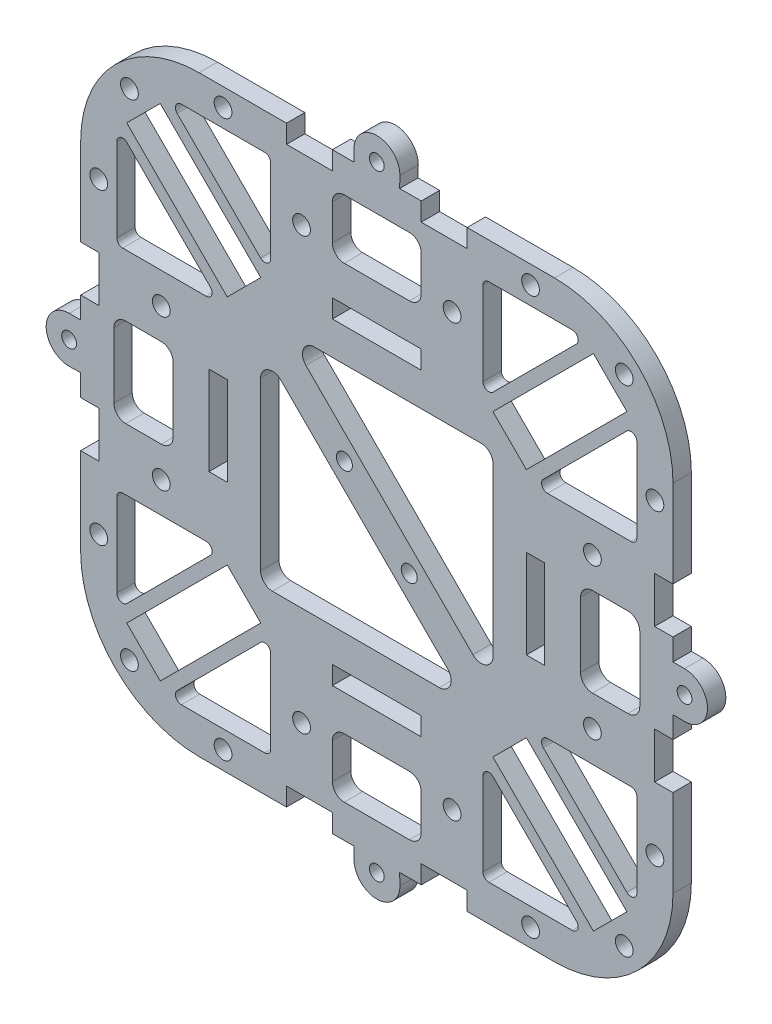
from build123d import *

# Parameters (mm, degrees)
SKETCH1_R      = 1.25
SKETCH1_R_2    = 1.5
SKETCH1_R_3    = 1.35
SKETCH1_W      = 15
SKETCH1_H      = 3.1
SKETCH1_W_2    = 3.1
SKETCH1_H_2    = 15
EXTRUDE1_DEPTH = 3.1


with BuildPart() as part:
    # Sketch1 → Extrude1 (new body)
    with BuildSketch(Plane.XY):
        with BuildLine():
            Line((11.101326835, -64.245781149), (7.453785482, -64.245781149))
            Line((7.453785482, -64.245781149), (7.453785482, -61.145781149))
            Line((7.453785482, -61.145781149), (-0.296214518, -61.145781149))
            Line((-0.296214518, -61.145781149), (-0.296214518, -64.245781149))
            Line((-0.296214518, -64.245781149), (-15.046214518, -64.245781149))
            ThreePointArc((-15.046214518, -64.245781149), (-29.188350141, -58.387916773), (-35.046214518, -44.245781149))
            Line((-35.046214518, -44.245781149), (-35.046214518, -29.495781149))
            Line((-35.046214518, -29.495781149), (-31.946214518, -29.495781149))
            Line((-31.946214518, -29.495781149), (-31.946214518, -21.745781149))
            Line((-31.946214518, -21.745781149), (-35.046214518, -21.745781149))
            Line((-35.046214518, -21.745781149), (-35.046214518, -18.098239797))
            Line((-35.046214518, -18.098239797), (-36.996214518, -18.143322501))
            ThreePointArc((-36.996214518, -18.143322501), (-40.871214518, -14.268322501), (-36.996214518, -10.393322501))
            Line((-36.996214518, -10.393322501), (-35.046214518, -10.393322501))
            Line((-35.046214518, -10.393322501), (-35.046214518, -6.745781149))
            Line((-35.046214518, -6.745781149), (-31.946214518, -6.745781149))
            Line((-31.946214518, -6.745781149), (-31.946214518, 1.004218851))
            Line((-31.946214518, 1.004218851), (-35.046214518, 1.004218851))
            Line((-35.046214518, 1.004218851), (-35.046214518, 15.754218851))
            ThreePointArc((-35.046214518, 15.754218851), (-29.188350141, 29.896354475), (-15.046214518, 35.754218851))
            Line((-15.046214518, 35.754218851), (-0.296214518, 35.754218851))
            Line((-0.296214518, 35.754218851), (-0.296214518, 32.654218851))
            Line((-0.296214518, 32.654218851), (7.453785482, 32.654218851))
            Line((7.453785482, 32.654218851), (7.453785482, 35.754218851))
            Line((7.453785482, 35.754218851), (11.101326835, 35.754218851))
            Line((11.101326835, 35.754218851), (11.101326835, 37.704218851))
            ThreePointArc((11.101326835, 37.704218851), (14.976326835, 41.579218851), (18.851326835, 37.704218851))
            Line((18.851326835, 37.704218851), (18.80624413, 35.754218851))
            Line((18.80624413, 35.754218851), (22.453785482, 35.754218851))
            Line((22.453785482, 35.754218851), (22.453785482, 32.654218851))
            Line((22.453785482, 32.654218851), (30.203785482, 32.654218851))
            Line((30.203785482, 32.654218851), (30.203785482, 35.754218851))
            Line((30.203785482, 35.754218851), (44.953785482, 35.754218851))
            ThreePointArc((44.953785482, 35.754218851), (59.095921106, 29.896354475), (64.953785482, 15.754218851))
            Line((64.953785482, 15.754218851), (64.953785482, 1.004218851))
            Line((64.953785482, 1.004218851), (61.853785482, 1.004218851))
            Line((61.853785482, 1.004218851), (61.853785482, -6.745781149))
            Line((61.853785482, -6.745781149), (64.953785482, -6.745781149))
            Line((64.953785482, -6.745781149), (64.953785482, -10.393322501))
            Line((64.953785482, -10.393322501), (66.903785482, -10.393322501))
            ThreePointArc((66.903785482, -10.393322501), (70.778785482, -14.268322501), (66.903785482, -18.143322501))
            Line((66.903785482, -18.143322501), (64.953785482, -18.098239797))
            Line((64.953785482, -18.098239797), (64.953785482, -21.745781149))
            Line((64.953785482, -21.745781149), (61.853785482, -21.745781149))
            Line((61.853785482, -21.745781149), (61.853785482, -29.495781149))
            Line((61.853785482, -29.495781149), (64.953785482, -29.495781149))
            Line((64.953785482, -29.495781149), (64.953785482, -44.245781149))
            ThreePointArc((64.953785482, -44.245781149), (59.095921106, -58.387916773), (44.953785482, -64.245781149))
            Line((44.953785482, -64.245781149), (30.203785482, -64.245781149))
            Line((30.203785482, -64.245781149), (30.203785482, -61.145781149))
            Line((30.203785482, -61.145781149), (22.453785482, -61.145781149))
            Line((22.453785482, -61.145781149), (22.453785482, -64.245781149))
            Line((22.453785482, -64.245781149), (18.80624413, -64.245781149))
            Line((18.80624413, -64.245781149), (18.851326835, -66.195781149))
            ThreePointArc((18.851326835, -66.195781149), (14.976326835, -70.070781149), (11.101326835, -66.195781149))
            Line((11.101326835, -66.195781149), (11.101326835, -64.245781149))
        make_face()
        with Locations(Location((-36.996214518, -14.245781149, 0), (0, 0, 180))):
            Circle(SKETCH1_R, mode=Mode.SUBTRACT)
        with Locations(Location((66.903785482, -14.245781149, 0), (0, 0, 180))):
            Circle(SKETCH1_R, mode=Mode.SUBTRACT)
        with Locations(Location((14.953785482, -66.195781149, 0), (0, 0, 180))):
            Circle(SKETCH1_R, mode=Mode.SUBTRACT)
        with Locations(Location((14.953785482, 37.704218851, 0), (0, 0, 180))):
            Circle(SKETCH1_R, mode=Mode.SUBTRACT)
        with Locations(Location((-26.81398147, -56.013548102, 0), (0, 0, 180))):
            Circle(SKETCH1_R_2, mode=Mode.SUBTRACT)
        with Locations(Location((56.721552435, -56.013548102, 0), (0, 0, 180))):
            Circle(SKETCH1_R_2, mode=Mode.SUBTRACT)
        with Locations(Location((-31.996593315, -40.204150588, 0), (0, 0, 180))):
            Circle(SKETCH1_R_2, mode=Mode.SUBTRACT)
        with Locations(Location((-11.004583957, -61.196159946, 0), (0, 0, 180))):
            Circle(SKETCH1_R_2, mode=Mode.SUBTRACT)
        with Locations(Location((61.90416428, -40.204150588, 0), (0, 0, 180))):
            Circle(SKETCH1_R_2, mode=Mode.SUBTRACT)
        with Locations(Location((40.912154922, -61.196159946, 0), (0, 0, 180))):
            Circle(SKETCH1_R_2, mode=Mode.SUBTRACT)
        with Locations(Location((61.90416428, 11.712588291, 0), (0, 0, 180))):
            Circle(SKETCH1_R_2, mode=Mode.SUBTRACT)
        with Locations(Location((56.721552435, 27.521985804, 0), (0, 0, 180))):
            Circle(SKETCH1_R_2, mode=Mode.SUBTRACT)
        with Locations(Location((40.912154922, 32.704597649, 0), (0, 0, 180))):
            Circle(SKETCH1_R_2, mode=Mode.SUBTRACT)
        with Locations(Location((-11.004583957, 32.704597649, 0), (0, 0, 180))):
            Circle(SKETCH1_R_2, mode=Mode.SUBTRACT)
        with Locations(Location((-26.81398147, 27.521985804, 0), (0, 0, 180))):
            Circle(SKETCH1_R_2, mode=Mode.SUBTRACT)
        with Locations(Location((-31.996593315, 11.712588291, 0), (0, 0, 180))):
            Circle(SKETCH1_R_2, mode=Mode.SUBTRACT)
        with Locations(Location((27.661575935, 22.149030378, 0), (0, 0, 180))):
            Circle(SKETCH1_R_2, mode=Mode.SUBTRACT)
        with Locations(Location((2.246099714, 22.149030378, 0), (0, 0, 180))):
            Circle(SKETCH1_R_2, mode=Mode.SUBTRACT)
        with Locations(Location((27.661575935, -50.637766186, 0), (0, 0, 180))):
            Circle(SKETCH1_R_2, mode=Mode.SUBTRACT)
        with Locations(Location((2.246099714, -50.637766186, 0), (0, 0, 180))):
            Circle(SKETCH1_R_2, mode=Mode.SUBTRACT)
        with Locations(Location((51.348649352, -26.952158357, 0), (0, 0, 180))):
            Circle(SKETCH1_R_2, mode=Mode.SUBTRACT)
        with Locations(Location((51.348649352, -1.536682136, 0), (0, 0, 180))):
            Circle(SKETCH1_R_2, mode=Mode.SUBTRACT)
        with Locations(Location((-21.438147213, -26.952158357, 0), (0, 0, 180))):
            Circle(SKETCH1_R_2, mode=Mode.SUBTRACT)
        with Locations(Location((-21.438147213, -1.536682136, 0), (0, 0, 180))):
            Circle(SKETCH1_R_2, mode=Mode.SUBTRACT)
        with Locations(Location((9.481274016, -8.773269682, 0), (0, 0, 180))):
            Circle(SKETCH1_R_3, mode=Mode.SUBTRACT)
        with Locations(Location((20.426296949, -19.718292616, 0), (0, 0, 180))):
            Circle(SKETCH1_R_3, mode=Mode.SUBTRACT)
        Polygon((-27.268039924, 22.319190009), (-21.611185675, 27.976044258), (-4.640622926, 11.00548151), (-10.297477176, 5.34862726), align=None, mode=Mode.SUBTRACT)
        Polygon((51.51875664, 27.976044258), (34.548193891, 11.00548151), (40.205048141, 5.34862726), (57.175610889, 22.319190009), align=None, mode=Mode.SUBTRACT)
        Polygon((57.175610889, -50.810752306), (51.51875664, -56.467606556), (34.548193891, -39.497043807), (40.205048141, -33.840189558), align=None, mode=Mode.SUBTRACT)
        Polygon((-21.611185675, -56.467606556), (-4.640622926, -39.497043807), (-10.297477176, -33.840189558), (-27.268039924, -50.810752306), align=None, mode=Mode.SUBTRACT)
        with Locations((14.953785482, -41.047043807)):
            Rectangle(SKETCH1_W, SKETCH1_H, mode=Mode.SUBTRACT)
        with Locations((41.755048141, -14.245781149)):
            Rectangle(SKETCH1_W_2, SKETCH1_H_2, mode=Mode.SUBTRACT)
        with Locations((-11.847477176, -14.245781149)):
            Rectangle(SKETCH1_W_2, SKETCH1_H_2, mode=Mode.SUBTRACT)
        with Locations((14.953785482, 12.55548151)):
            Rectangle(SKETCH1_W, SKETCH1_H, mode=Mode.SUBTRACT)
        with BuildLine():
            Line((-1.253321299, -2.281315055), (26.918251577, -30.45288793))
            ThreePointArc((26.918251577, -30.45288793), (27.351797079, -32.632468357), (25.504038014, -33.867101492))
            Line((25.504038014, -33.867101492), (-2.667534861, -33.867101492))
            ThreePointArc((-2.667534861, -33.867101492), (-4.081748423, -33.281315055), (-4.667534861, -31.867101492))
            Line((-4.667534861, -31.867101492), (-4.667534861, -3.695528617))
            ThreePointArc((-4.667534861, -3.695528617), (-3.432901726, -1.847769552), (-1.253321299, -2.281315055))
        make_face(mode=Mode.SUBTRACT)
        with BuildLine():
            Line((2.989319388, 1.961325632), (31.160892264, -26.210247243))
            ThreePointArc((31.160892264, -26.210247243), (33.340472691, -26.643792746), (34.575105826, -24.79603368))
            Line((34.575105826, -24.79603368), (34.575105826, 3.375539195))
            ThreePointArc((34.575105826, 3.375539195), (33.989319388, 4.789752757), (32.575105826, 5.375539195))
            Line((32.575105826, 5.375539195), (4.403532951, 5.375539195))
            ThreePointArc((4.403532951, 5.375539195), (2.555773886, 4.140906059), (2.989319388, 1.961325632))
        make_face(mode=Mode.SUBTRACT)
        with BuildLine():
            Line((9.453785482, 30.147617133), (20.453785482, 30.147617133))
            ThreePointArc((20.453785482, 30.147617133), (21.867999045, 29.561830696), (22.453785482, 28.147617133))
            Line((22.453785482, 28.147617133), (22.453785482, 22.147617133))
            ThreePointArc((22.453785482, 22.147617133), (21.867999045, 20.733403571), (20.453785482, 20.147617133))
            Line((20.453785482, 20.147617133), (9.453785482, 20.147617133))
            ThreePointArc((9.453785482, 20.147617133), (8.03957192, 20.733403571), (7.453785482, 22.147617133))
            Line((7.453785482, 22.147617133), (7.453785482, 28.147617133))
            ThreePointArc((7.453785482, 28.147617133), (8.03957192, 29.561830696), (9.453785482, 30.147617133))
        make_face(mode=Mode.SUBTRACT)
        with BuildLine():
            Line((33.869261703, 29.654976446), (47.955048141, 29.654976446))
            ThreePointArc((47.955048141, 29.654976446), (48.878927673, 29.037659879), (48.662154922, 27.947869665))
            Line((48.662154922, 27.947869665), (34.576368485, 13.862083227))
            ThreePointArc((34.576368485, 13.862083227), (33.486578271, 13.645310476), (32.869261703, 14.569190009))
            Line((32.869261703, 14.569190009), (32.869261703, 28.654976446))
            ThreePointArc((32.869261703, 28.654976446), (33.162154922, 29.362083227), (33.869261703, 29.654976446))
        make_face(mode=Mode.SUBTRACT)
        with BuildLine():
            Line((43.061649859, 5.376801853), (57.147436296, 19.462588291))
            ThreePointArc((57.147436296, 19.462588291), (58.23722651, 19.679361042), (58.854543078, 18.75548151))
            Line((58.854543078, 18.75548151), (58.854543078, 4.669695072))
            ThreePointArc((58.854543078, 4.669695072), (58.561649859, 3.962588291), (57.854543078, 3.669695072))
            Line((57.854543078, 3.669695072), (43.76875664, 3.669695072))
            ThreePointArc((43.76875664, 3.669695072), (42.844877107, 4.28701164), (43.061649859, 5.376801853))
        make_face(mode=Mode.SUBTRACT)
        with BuildLine():
            Line((43.76875664, -32.16125737), (57.854543078, -32.16125737))
            ThreePointArc((57.854543078, -32.16125737), (58.561649859, -32.454150588), (58.854543078, -33.16125737))
            Line((58.854543078, -33.16125737), (58.854543078, -47.247043807))
            ThreePointArc((58.854543078, -47.247043807), (58.23722651, -48.17092334), (57.147436296, -47.954150588))
            Line((57.147436296, -47.954150588), (43.061649859, -33.868364151))
            ThreePointArc((43.061649859, -33.868364151), (42.844877107, -32.778573937), (43.76875664, -32.16125737))
        make_face(mode=Mode.SUBTRACT)
        with BuildLine():
            Line((34.576368485, -42.353645525), (48.662154922, -56.439431963))
            ThreePointArc((48.662154922, -56.439431963), (48.878927673, -57.529222176), (47.955048141, -58.146538744))
            Line((47.955048141, -58.146538744), (33.869261703, -58.146538744))
            ThreePointArc((33.869261703, -58.146538744), (33.162154922, -57.853645525), (32.869261703, -57.146538744))
            Line((32.869261703, -57.146538744), (32.869261703, -43.060752306))
            ThreePointArc((32.869261703, -43.060752306), (33.486578271, -42.136872774), (34.576368485, -42.353645525))
        make_face(mode=Mode.SUBTRACT)
        with BuildLine():
            Line((-2.961690738, 14.569190009), (-2.961690738, 28.654976446))
            ThreePointArc((-2.961690738, 28.654976446), (-3.254583957, 29.362083227), (-3.961690738, 29.654976446))
            Line((-3.961690738, 29.654976446), (-18.047477176, 29.654976446))
            ThreePointArc((-18.047477176, 29.654976446), (-18.971356708, 29.037659879), (-18.754583957, 27.947869665))
            Line((-18.754583957, 27.947869665), (-4.66879752, 13.862083227))
            ThreePointArc((-4.66879752, 13.862083227), (-3.579007306, 13.645310476), (-2.961690738, 14.569190009))
        make_face(mode=Mode.SUBTRACT)
        with BuildLine():
            Line((-3.961690738, -58.146538744), (-18.047477176, -58.146538744))
            ThreePointArc((-18.047477176, -58.146538744), (-18.971356708, -57.529222176), (-18.754583957, -56.439431963))
            Line((-18.754583957, -56.439431963), (-4.66879752, -42.353645525))
            ThreePointArc((-4.66879752, -42.353645525), (-3.579007306, -42.136872774), (-2.961690738, -43.060752306))
            Line((-2.961690738, -43.060752306), (-2.961690738, -57.146538744))
            ThreePointArc((-2.961690738, -57.146538744), (-3.254583957, -57.853645525), (-3.961690738, -58.146538744))
        make_face(mode=Mode.SUBTRACT)
        with BuildLine():
            Line((-13.861185675, -32.16125737), (-27.946972113, -32.16125737))
            ThreePointArc((-27.946972113, -32.16125737), (-28.654078894, -32.454150588), (-28.946972113, -33.16125737))
            Line((-28.946972113, -33.16125737), (-28.946972113, -47.247043807))
            ThreePointArc((-28.946972113, -47.247043807), (-28.329655545, -48.17092334), (-27.239865331, -47.954150588))
            Line((-27.239865331, -47.954150588), (-13.154078894, -33.868364151))
            ThreePointArc((-13.154078894, -33.868364151), (-12.937306142, -32.778573937), (-13.861185675, -32.16125737))
        make_face(mode=Mode.SUBTRACT)
        with BuildLine():
            Line((-28.946972113, 4.669695072), (-28.946972113, 18.75548151))
            ThreePointArc((-28.946972113, 18.75548151), (-28.329655545, 19.679361042), (-27.239865331, 19.462588291))
            Line((-27.239865331, 19.462588291), (-13.154078894, 5.376801853))
            ThreePointArc((-13.154078894, 5.376801853), (-12.937306142, 4.28701164), (-13.861185675, 3.669695072))
            Line((-13.861185675, 3.669695072), (-27.946972113, 3.669695072))
            ThreePointArc((-27.946972113, 3.669695072), (-28.654078894, 3.962588291), (-28.946972113, 4.669695072))
        make_face(mode=Mode.SUBTRACT)
        with BuildLine():
            Line((22.453785482, -56.639179431), (22.453785482, -50.639179431))
            ThreePointArc((22.453785482, -50.639179431), (21.867999045, -49.224965869), (20.453785482, -48.639179431))
            Line((20.453785482, -48.639179431), (9.453785482, -48.639179431))
            ThreePointArc((9.453785482, -48.639179431), (8.03957192, -49.224965869), (7.453785482, -50.639179431))
            Line((7.453785482, -50.639179431), (7.453785482, -56.639179431))
            ThreePointArc((7.453785482, -56.639179431), (8.03957192, -58.053392993), (9.453785482, -58.639179431))
            Line((9.453785482, -58.639179431), (20.453785482, -58.639179431))
            ThreePointArc((20.453785482, -58.639179431), (21.867999045, -58.053392993), (22.453785482, -56.639179431))
        make_face(mode=Mode.SUBTRACT)
        with BuildLine():
            Line((-29.4396128, -19.745781149), (-29.4396128, -8.745781149))
            ThreePointArc((-29.4396128, -8.745781149), (-28.853826362, -7.331567586), (-27.4396128, -6.745781149))
            Line((-27.4396128, -6.745781149), (-21.4396128, -6.745781149))
            ThreePointArc((-21.4396128, -6.745781149), (-20.025399237, -7.331567586), (-19.4396128, -8.745781149))
            Line((-19.4396128, -8.745781149), (-19.4396128, -19.745781149))
            ThreePointArc((-19.4396128, -19.745781149), (-20.025399237, -21.159994711), (-21.4396128, -21.745781149))
            Line((-21.4396128, -21.745781149), (-27.4396128, -21.745781149))
            ThreePointArc((-27.4396128, -21.745781149), (-28.853826362, -21.159994711), (-29.4396128, -19.745781149))
        make_face(mode=Mode.SUBTRACT)
        with BuildLine():
            Line((57.347183765, -21.745781149), (51.347183765, -21.745781149))
            ThreePointArc((51.347183765, -21.745781149), (49.932970202, -21.159994711), (49.347183765, -19.745781149))
            Line((49.347183765, -19.745781149), (49.347183765, -8.745781149))
            ThreePointArc((49.347183765, -8.745781149), (49.932970202, -7.331567586), (51.347183765, -6.745781149))
            Line((51.347183765, -6.745781149), (57.347183765, -6.745781149))
            ThreePointArc((57.347183765, -6.745781149), (58.761397327, -7.331567586), (59.347183765, -8.745781149))
            Line((59.347183765, -8.745781149), (59.347183765, -19.745781149))
            ThreePointArc((59.347183765, -19.745781149), (58.761397327, -21.159994711), (57.347183765, -21.745781149))
        make_face(mode=Mode.SUBTRACT)
    extrude(amount=EXTRUDE1_DEPTH)


solid = part.part
